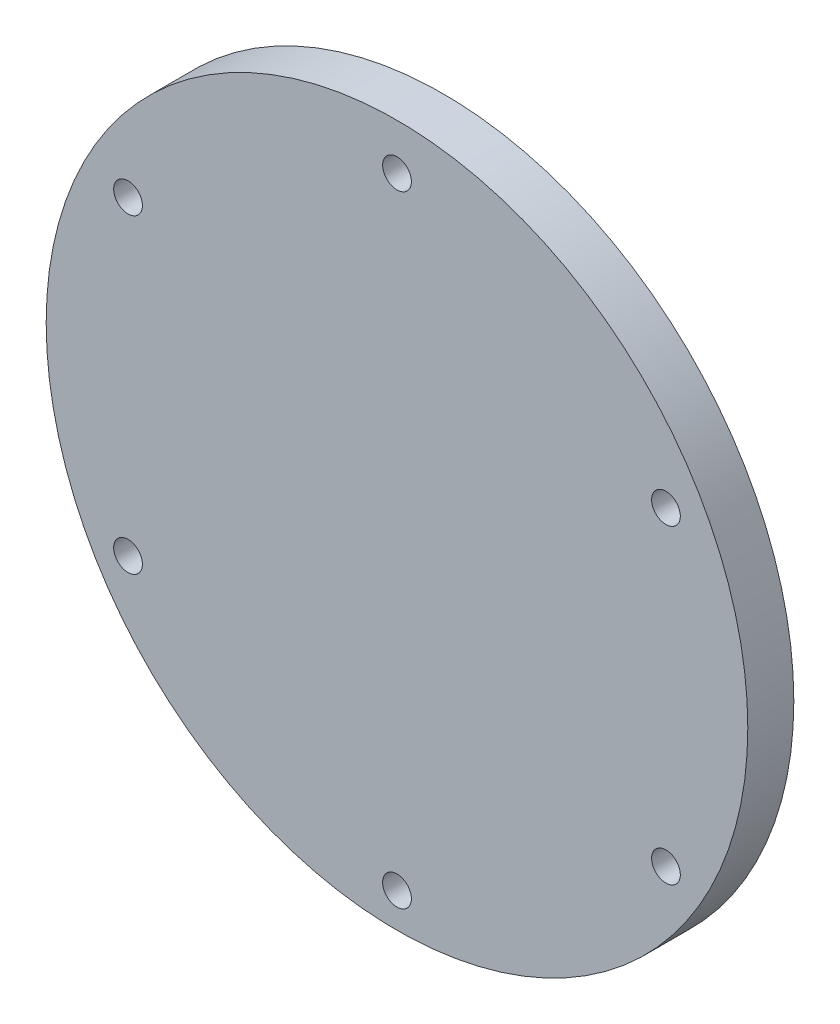
from build123d import *

# Parameters (mm, degrees)
SKETCH1_R           = 61
SKETCH1_R_2         = 2.5
BOSS_EXTRUDE1_DEPTH = 8


with BuildPart() as part:
    # Sketch1 → Boss-Extrude1 (new body)
    with BuildSketch(Plane(origin=(0, 0, 0), x_dir=(-1, 0, 0), z_dir=(0, 0, 1))):
        with Locations(Location((0, -1, 0), (0, 0, 180))):
            Circle(SKETCH1_R)
        with Locations(Location((0, 54, 0), (0, 0, 180))):
            Circle(SKETCH1_R_2, mode=Mode.SUBTRACT)
        with Locations(Location((46.765371804, 27, 0), (0, 0, 180))):
            Circle(SKETCH1_R_2, mode=Mode.SUBTRACT)
        with Locations(Location((46.765371804, -27, 0), (0, 0, 180))):
            Circle(SKETCH1_R_2, mode=Mode.SUBTRACT)
        with Locations(Location((0, -54, 0), (0, 0, 180))):
            Circle(SKETCH1_R_2, mode=Mode.SUBTRACT)
        with Locations(Location((-46.765371804, -27, 0), (0, 0, 180))):
            Circle(SKETCH1_R_2, mode=Mode.SUBTRACT)
        with Locations(Location((-46.765371804, 27, 0), (0, 0, 180))):
            Circle(SKETCH1_R_2, mode=Mode.SUBTRACT)
    extrude(amount=BOSS_EXTRUDE1_DEPTH)


solid = part.part
